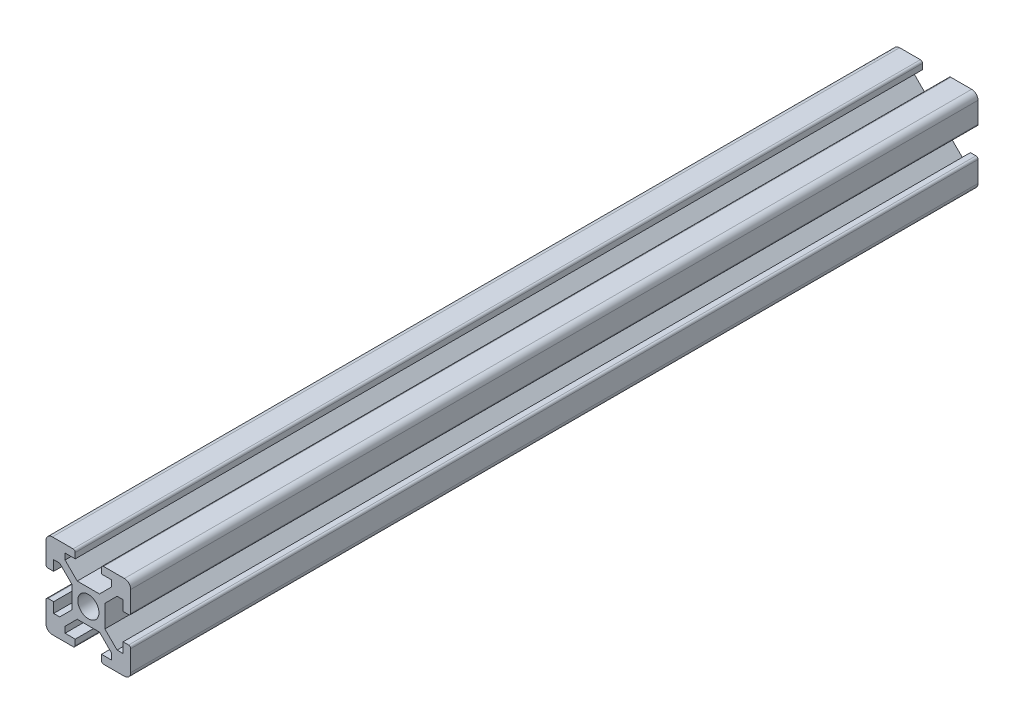
from build123d import *

# Parameters (mm, degrees)
SKETCH_1_R      = 2.5
EXTRUDE_1_DEPTH = 200
FILLET_1_R      = 1.5
FILLET_2_R      = 1.5
FILLET_3_R      = 1.5
FILLET_4_R      = 1.5
FILLET_5_R      = 0.5
FILLET_6_R      = 0.5
FILLET_7_R      = 0.5
FILLET_8_R      = 0.5
FILLET_9_R      = 0.5
FILLET_10_R     = 0.5
FILLET_11_R     = 0.5
FILLET_12_R     = 0.5


with BuildPart() as part:
    # 草图1 → 凸台-拉伸1 (new body)
    with BuildSketch(Plane.XY):
        Polygon((0, 6.9), (0, 0), (6.9, 0), (6.9, 1.8), (4.5, 1.8), (4.5, 3.227207794), (7.372792206, 6.1), (12.627207794, 6.1), (15.5, 3.227207794), (15.5, 1.8), (13.1, 1.8), (13.1, 0), (20, 0), (20, 6.9), (18.2, 6.9), (18.2, 4.5), (16.772792206, 4.5), (13.9, 7.372792206), (13.9, 12.627207794), (16.772792206, 15.5), (18.2, 15.5), (18.2, 13.1), (20, 13.1), (20, 20), (13.1, 20), (13.1, 18.2), (15.5, 18.2), (15.5, 16.772792206), (12.627207794, 13.9), (7.372792206, 13.9), (4.5, 16.772792206), (4.5, 18.2), (6.9, 18.2), (6.9, 20), (0, 20), (0, 13.1), (1.8, 13.1), (1.8, 15.5), (3.227207794, 15.5), (6.1, 12.627207794), (6.1, 7.372792206), (3.227207794, 4.5), (1.8, 4.5), (1.8, 6.9), align=None)
        with Locations((10, 10)):
            Circle(SKETCH_1_R, mode=Mode.SUBTRACT)
    extrude(amount=EXTRUDE_1_DEPTH)

    # 圆角1
    fillet_1_edges = [part.edges().sort_by_distance(p)[0] for p in [
        (20, 20, 100),
    ]]
    fillet(fillet_1_edges, radius=FILLET_1_R)

    # 圆角2
    fillet_2_edges = [part.edges().sort_by_distance(p)[0] for p in [
        (0, 20, 100),
    ]]
    fillet(fillet_2_edges, radius=FILLET_2_R)

    # 圆角3
    fillet_3_edges = [part.edges().sort_by_distance(p)[0] for p in [
        (0, 0, 100),
    ]]
    fillet(fillet_3_edges, radius=FILLET_3_R)

    # 圆角4
    fillet_4_edges = [part.edges().sort_by_distance(p)[0] for p in [
        (20, 0, 100),
    ]]
    fillet(fillet_4_edges, radius=FILLET_4_R)

    # 圆角5
    fillet_5_edges = [part.edges().sort_by_distance(p)[0] for p in [
        (13.1, 20, 100),
    ]]
    fillet(fillet_5_edges, radius=FILLET_5_R)

    # 圆角6
    fillet_6_edges = [part.edges().sort_by_distance(p)[0] for p in [
        (6.9, 20, 100),
    ]]
    fillet(fillet_6_edges, radius=FILLET_6_R)

    # 圆角7
    fillet_7_edges = [part.edges().sort_by_distance(p)[0] for p in [
        (0, 13.1, 100),
    ]]
    fillet(fillet_7_edges, radius=FILLET_7_R)

    # 圆角8
    fillet_8_edges = [part.edges().sort_by_distance(p)[0] for p in [
        (0, 6.9, 100),
    ]]
    fillet(fillet_8_edges, radius=FILLET_8_R)

    # 圆角9
    fillet_9_edges = [part.edges().sort_by_distance(p)[0] for p in [
        (6.9, 0, 100),
    ]]
    fillet(fillet_9_edges, radius=FILLET_9_R)

    # 圆角10
    fillet_10_edges = [part.edges().sort_by_distance(p)[0] for p in [
        (13.1, 0, 100),
    ]]
    fillet(fillet_10_edges, radius=FILLET_10_R)

    # 圆角11
    fillet_11_edges = [part.edges().sort_by_distance(p)[0] for p in [
        (20, 13.1, 100),
    ]]
    fillet(fillet_11_edges, radius=FILLET_11_R)

    # 圆角12
    fillet_12_edges = [part.edges().sort_by_distance(p)[0] for p in [
        (20, 6.9, 100),
    ]]
    fillet(fillet_12_edges, radius=FILLET_12_R)


solid = part.part
